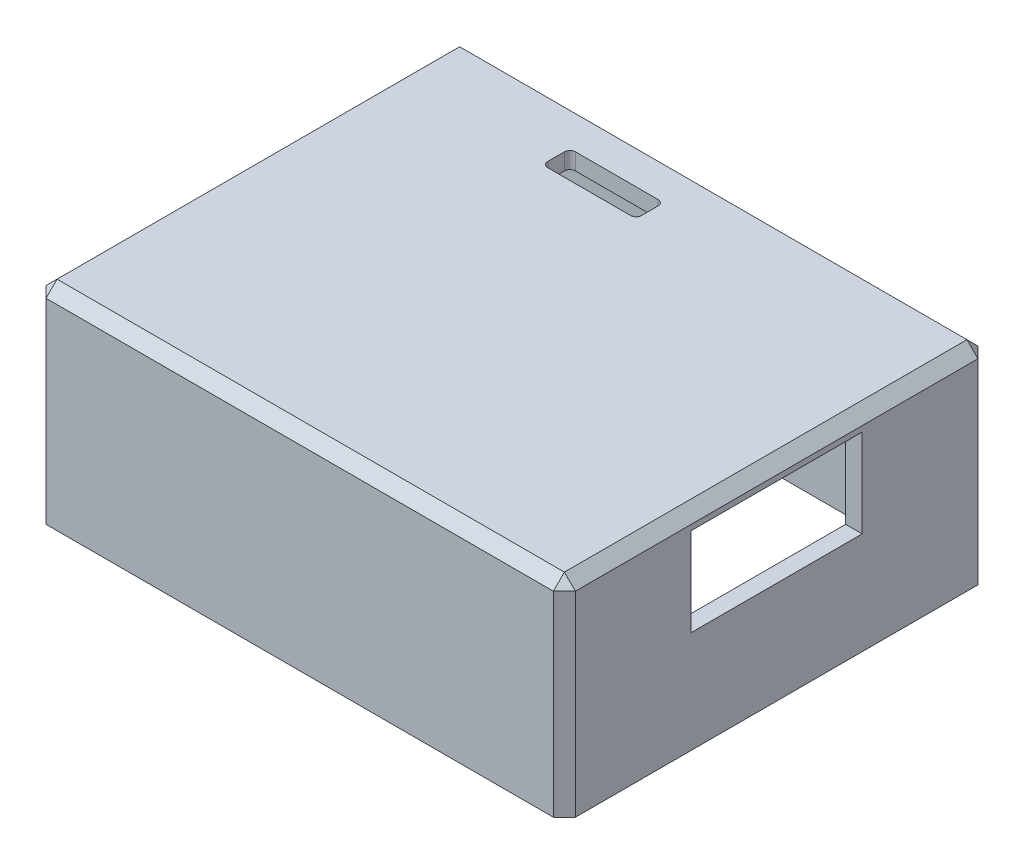
from build123d import *

# Parameters (mm, degrees)
SKETCH2_W           = 24.384
SKETCH2_H           = 19.558
BOSS_EXTRUDE1_DEPTH = 6.477
SKETCH1_W           = 22.86
SKETCH1_H           = 18.034
CUT_EXTRUDE1_DEPTH  = 5.715
SKETCH3_W           = 24.384
SKETCH3_H           = 19.558
SKETCH3_W_2         = 22.86
SKETCH3_H_2         = 18.034
BOSS_EXTRUDE2_DEPTH = 3.048
CUT_EXTRUDE2_REACH  = 33.461
SKETCH4_W           = 6.35
SKETCH4_H           = 6.096
CUT_EXTRUDE3_REACH  = 33.461
SKETCH5_W           = 7.874
SKETCH5_H           = 4.064
CHAMFER1_SIZE       = 0.508
CUT_EXTRUDE4_REACH  = 33.655
SKETCH7_W           = 1.524
SKETCH7_H           = 1.524
BOSS_EXTRUDE3_DEPTH = 4.064


with BuildPart() as part:
    # Sketch2 → Boss-Extrude1 (new body)
    with BuildSketch(Plane(origin=(0, 0, 0), x_dir=(1, 0, 0), z_dir=(0, 1, 0))):
        with Locations((11.43, 9.017)):
            Rectangle(SKETCH2_W, SKETCH2_H)
    extrude(amount=BOSS_EXTRUDE1_DEPTH)

    # Sketch1 → Cut-Extrude1 (cut)
    with BuildSketch(Plane(origin=(0, 0, 0), x_dir=(1, 0, 0), z_dir=(0, 1, 0))):
        with Locations((11.43, 9.017)):
            Rectangle(SKETCH1_W, SKETCH1_H)
    extrude(amount=CUT_EXTRUDE1_DEPTH, mode=Mode.SUBTRACT)

    # Sketch3 → Boss-Extrude2 (add)
    with BuildSketch(Plane.XZ):
        with Locations((11.43, -9.017)):
            Rectangle(SKETCH3_W, SKETCH3_H)
        with Locations((11.43, -9.017)):
            Rectangle(SKETCH3_W_2, SKETCH3_H_2, mode=Mode.SUBTRACT)
    extrude(amount=BOSS_EXTRUDE2_DEPTH)

    # Sketch4 → Cut-Extrude2 (cut, up to next)
    with BuildSketch(Plane.ZY.offset(0.762), mode=Mode.PRIVATE) as cut_extrude2_sk1:
        with Locations((-9.017, -3.048)):
            Rectangle(SKETCH4_W, SKETCH4_H)
    cut_extrude2_tool1 = extrude(cut_extrude2_sk1.sketch, amount=-CUT_EXTRUDE2_REACH, mode=Mode.PRIVATE) & part.part
    add(cut_extrude2_tool1.solids().sort_by_distance((-0.762, -3.048, -9.017))[0], mode=Mode.SUBTRACT)

    # Sketch5 → Cut-Extrude3 (cut, up to next)
    with BuildSketch(Plane(origin=(23.622, 0, 0), x_dir=(0, 0, -1), z_dir=(1, 0, 0)), mode=Mode.PRIVATE) as cut_extrude3_sk1:
        with Locations((9.017, 3.683)):
            Rectangle(SKETCH5_W, SKETCH5_H)
    cut_extrude3_tool1 = extrude(cut_extrude3_sk1.sketch, amount=-CUT_EXTRUDE3_REACH, mode=Mode.PRIVATE) & part.part
    add(cut_extrude3_tool1.solids().sort_by_distance((23.622, 3.683, -9.017))[0], mode=Mode.SUBTRACT)

    # Chamfer1
    chamfer1_edges = [part.edges().sort_by_distance(p)[0] for p in [
        (23.622, 6.477, -9.017),
        (11.43, 6.477, -18.796),
        (-0.762, 6.477, -9.017),
        (11.43, 6.477, 0.762),
        (-0.762, 1.7145, -18.796),
        (23.622, 1.7145, -18.796),
        (23.622, 1.7145, 0.762),
        (-0.762, 1.7145, 0.762),
    ]]
    chamfer(chamfer1_edges, length=CHAMFER1_SIZE)

    # Sketch6 → Cut-Extrude4 (cut, up to next)
    with BuildSketch(Plane(origin=(0, 6.477, 0), x_dir=(1, 0, 0), z_dir=(0, 1, 0)), mode=Mode.PRIVATE) as cut_extrude4_sk1:
        with BuildLine():
            Line((6.604, 16.764), (10.414, 16.764))
            ThreePointArc((10.414, 16.764), (10.593605122, 16.689605122), (10.668, 16.51))
            Line((10.668, 16.51), (10.668, 15.748))
            ThreePointArc((10.668, 15.748), (10.593605122, 15.568394878), (10.414, 15.494))
            Line((10.414, 15.494), (6.604, 15.494))
            ThreePointArc((6.604, 15.494), (6.424394878, 15.568394878), (6.35, 15.748))
            Line((6.35, 15.748), (6.35, 16.51))
            ThreePointArc((6.35, 16.51), (6.424394878, 16.689605122), (6.604, 16.764))
        make_face()
    cut_extrude4_tool1 = extrude(cut_extrude4_sk1.sketch, amount=-CUT_EXTRUDE4_REACH, mode=Mode.PRIVATE) & part.part
    add(cut_extrude4_tool1.solids().sort_by_distance((8.509, 6.477, -16.129))[0], mode=Mode.SUBTRACT)

    # Sketch7 → Boss-Extrude3 (add)
    with BuildSketch(Plane.XZ.offset(-5.715)):
        with Locations((0.762, -17.272)):
            Rectangle(SKETCH7_W, SKETCH7_H)
        with Locations((0.762, -0.762)):
            Rectangle(SKETCH7_W, SKETCH7_H)
    extrude(amount=BOSS_EXTRUDE3_DEPTH)


solid = part.part
